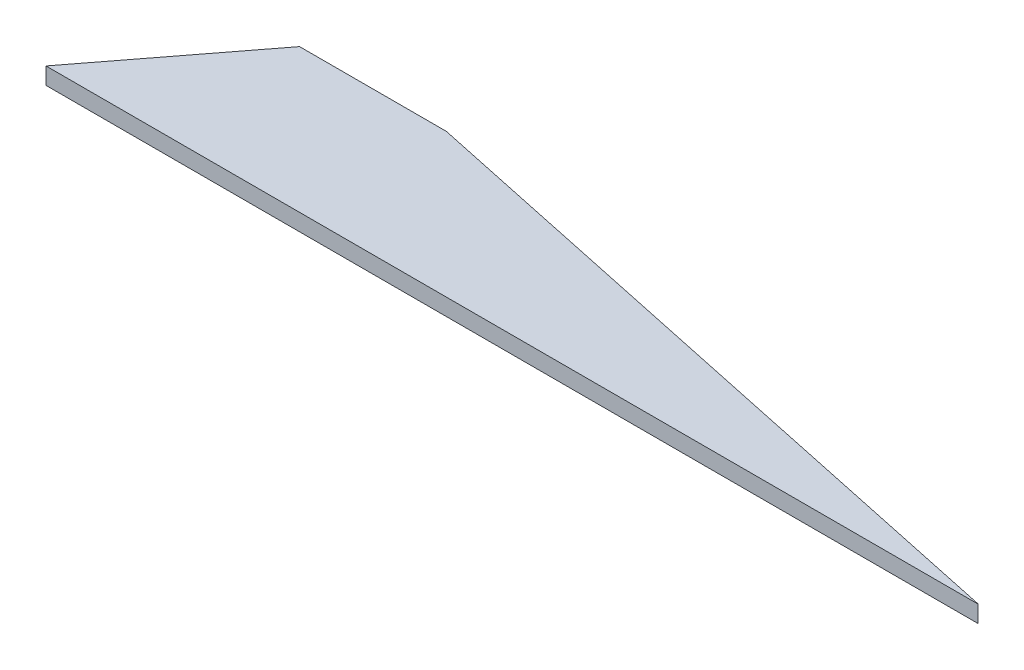
from build123d import *

# Parameters (mm, degrees)
SKETCH1_W           = 263.3434916
SKETCH1_H           = 204.19140391
BOSS_EXTRUDE1_DEPTH = 4.599999944
SKETCH3_OUTSIDE_W   = 331.995
SKETCH3_OUTSIDE_H   = 272.843
CUT_EXTRUDE2_DEPTH  = 334.264285513


with BuildPart() as part:
    # Sketch1 → Boss-Extrude1 (new body)
    with BuildSketch(Plane(origin=(0, 0, 0), x_dir=(1, 0, 0), z_dir=(0, 1, 0))):
        with Locations((131.6717458, 102.095701955)):
            Rectangle(SKETCH1_W, SKETCH1_H)
    extrude(amount=BOSS_EXTRUDE1_DEPTH)

    # Sketch3 outside → Cut-Extrude2 (cut, through all)
    with BuildSketch(Plane.XZ):
        with Locations((131.6715, -102.0955)):
            Rectangle(SKETCH3_OUTSIDE_W, SKETCH3_OUTSIDE_H)
        Polygon((263.3434916, -0.049915823), (263.3434916, 0), (9.354726888, 0), (9.353322236, 0), (39.343491544, -39.121080253), (79.343491554, -39.121080253), align=None, mode=Mode.SUBTRACT)
    extrude(amount=-CUT_EXTRUDE2_DEPTH, mode=Mode.SUBTRACT)


solid = part.part
